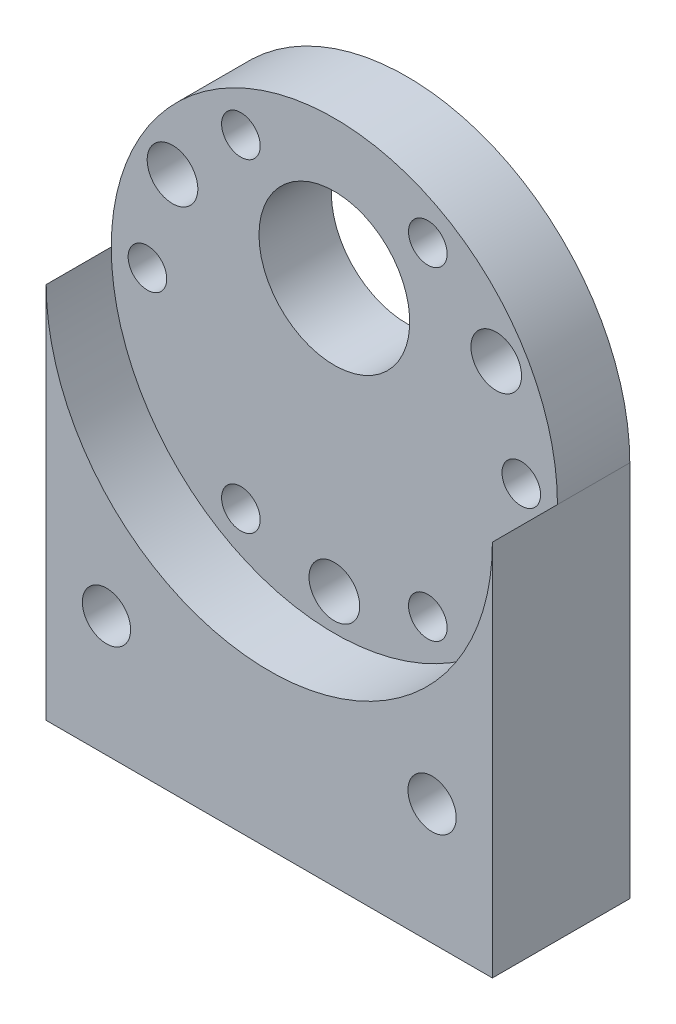
from build123d import *

# Parameters (mm, degrees)
SKETCH1_R           = 18.5
SKETCH1_R_2         = 6.25
SKETCH1_R_3         = 1.6
SKETCH1_R_4         = 2.1
BOSS_EXTRUDE1_DEPTH = 6
BOSS_EXTRUDE2_START = -6
SKETCH3_R           = 2
BOSS_EXTRUDE2_DEPTH = 11.395208
SKETCH4_R           = 3.5
CUT_EXTRUDE1_DEPTH  = 5


with BuildPart() as part:
    # Sketch1 → Boss-Extrude1 (new body)
    with BuildSketch(Plane.XY):
        with Locations(Location((0, 0, 0), (0, 0, 180))):
            Circle(SKETCH1_R)
        with Locations(Location((0, 7, 0), (0, 0, 180))):
            Circle(SKETCH1_R_2, mode=Mode.SUBTRACT)
        with Locations(Location((15.5, 0, 0), (0, 0, 180))):
            Circle(SKETCH1_R_3, mode=Mode.SUBTRACT)
        with Locations(Location((7.75, -13.423393759, 0), (0, 0, 180))):
            Circle(SKETCH1_R_3, mode=Mode.SUBTRACT)
        with Locations(Location((-7.75, -13.423393759, 0), (0, 0, 180))):
            Circle(SKETCH1_R_3, mode=Mode.SUBTRACT)
        with Locations(Location((-15.5, 0, 0), (0, 0, 180))):
            Circle(SKETCH1_R_3, mode=Mode.SUBTRACT)
        with Locations(Location((-7.75, 13.423393759, 0), (0, 0, 180))):
            Circle(SKETCH1_R_3, mode=Mode.SUBTRACT)
        with Locations(Location((7.75, 13.423393759, 0), (0, 0, 180))):
            Circle(SKETCH1_R_3, mode=Mode.SUBTRACT)
        with Locations(Location((13.423393759, 7.75, 0), (0, 0, 180))):
            Circle(SKETCH1_R_4, mode=Mode.SUBTRACT)
        with Locations(Location((0, -15.5, 0), (0, 0, 180))):
            Circle(SKETCH1_R_4, mode=Mode.SUBTRACT)
        with Locations(Location((-13.423393759, 7.75, 0), (0, 0, 180))):
            Circle(SKETCH1_R_4, mode=Mode.SUBTRACT)
    extrude(amount=BOSS_EXTRUDE1_DEPTH)

    # Sketch3 → Boss-Extrude2 (add)
    with BuildSketch(Plane.XY.offset(6).offset(BOSS_EXTRUDE2_START)):
        with BuildLine():
            ThreePointArc((18.5, 0), (0, -18.5), (-18.5, 0))
            Line((-18.5, 0), (-18.5, -31.300991))
            Line((-18.5, -31.300991), (18.5, -31.300991))
            Line((18.5, -31.300991), (18.5, 0))
        make_face()
        with Locations(Location((-13.5, -21.300991, 0), (0, 0, 270))):
            Circle(SKETCH3_R, mode=Mode.SUBTRACT)
        with Locations(Location((13.5, -21.300991, 0), (0, 0, 270))):
            Circle(SKETCH3_R, mode=Mode.SUBTRACT)
    extrude(amount=BOSS_EXTRUDE2_DEPTH)

    # Sketch4 → Cut-Extrude1 (cut)
    with BuildSketch(Plane(origin=(0, 0, 0), x_dir=(-1, 0, 0), z_dir=(0, 0, -1))):
        with Locations((-13.5, -21.300991)):
            Circle(SKETCH4_R)
        with Locations((13.5, -21.300991)):
            Circle(SKETCH4_R)
    extrude(amount=-CUT_EXTRUDE1_DEPTH, mode=Mode.SUBTRACT)


solid = part.part
